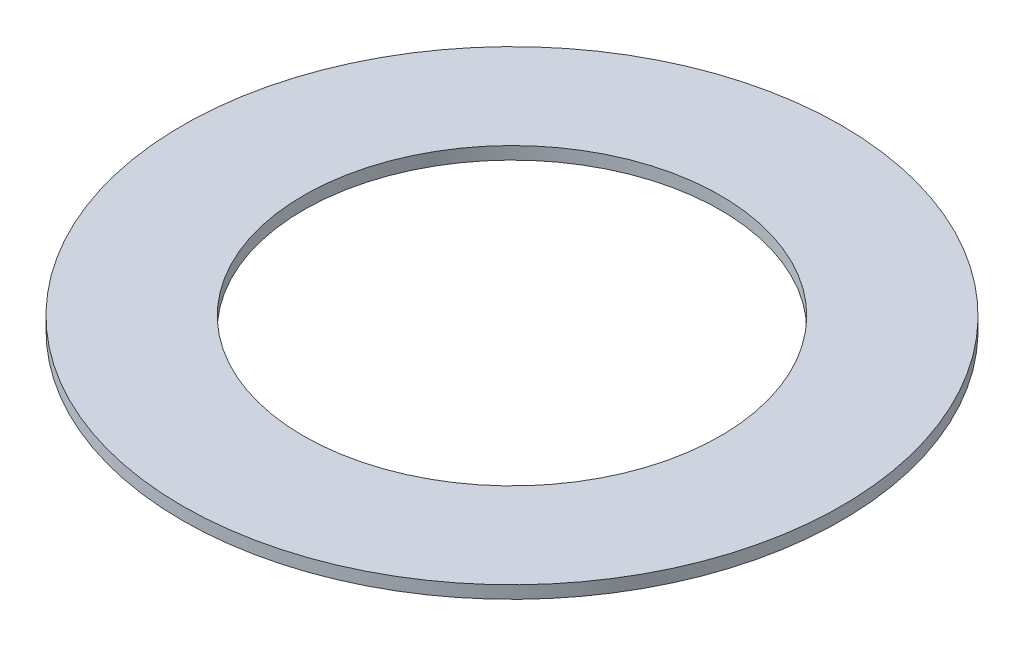
from build123d import *

# Parameters (mm, degrees)
SKETCH1_R           = 78.35
SKETCH1_R_2         = 49.55
BOSS_EXTRUDE1_DEPTH = 3


with BuildPart() as part:
    # Sketch1 → Boss-Extrude1 (new body)
    with BuildSketch(Plane(origin=(0, 0, 0), x_dir=(1, 0, 0), z_dir=(0, 1, 0))):
        with Locations(Location((0, 0, 0), (0, 0, 270))):
            Circle(SKETCH1_R)
        with Locations(Location((0, 0, 0), (0, 0, 270))):
            Circle(SKETCH1_R_2, mode=Mode.SUBTRACT)
    extrude(amount=BOSS_EXTRUDE1_DEPTH)


solid = part.part
